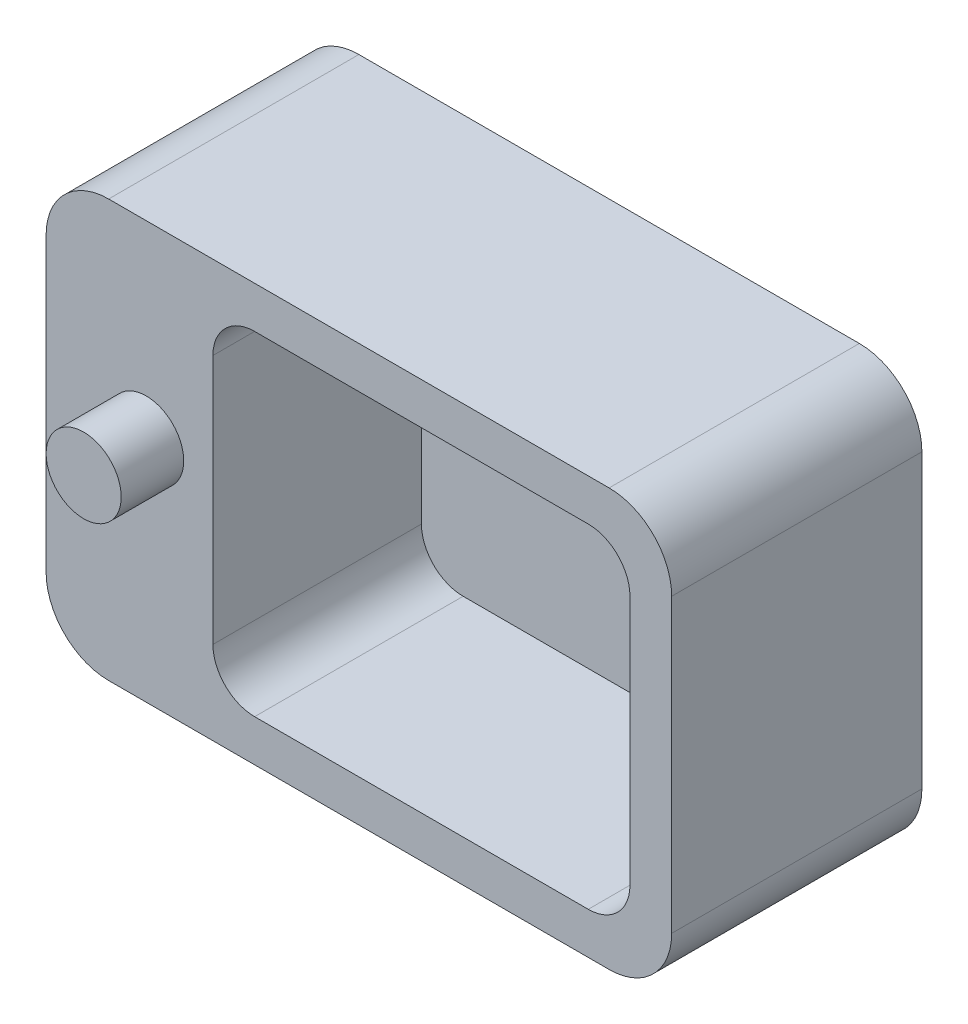
from build123d import *

# Parameters (mm, degrees)
BASE_EXTRUDE_DEPTH  = 60
CUT_EXTRUDE1_DEPTH  = 50
SKETCH3_R           = 9
BOSS_EXTRUDE1_DEPTH = 15


with BuildPart() as part:
    # Sketch1 → Base-Extrude (new body)
    with BuildSketch(Plane.XY):
        with BuildLine():
            Line((15, 0), (135, 0))
            ThreePointArc((135, 0), (145.606601718, 4.393398282), (150, 15))
            Line((150, 15), (150, 85))
            ThreePointArc((150, 85), (145.606601718, 95.606601718), (135, 100))
            Line((135, 100), (15, 100))
            ThreePointArc((15, 100), (4.393398282, 95.606601718), (0, 85))
            Line((0, 85), (0, 15))
            ThreePointArc((0, 15), (4.393398282, 4.393398282), (15, 0))
        make_face()
    extrude(amount=BASE_EXTRUDE_DEPTH)

    # Sketch2 → Cut-Extrude1 (cut)
    with BuildSketch(Plane.XY.offset(60)):
        with BuildLine():
            Line((40, 80), (40, 20))
            ThreePointArc((40, 20), (42.928932188, 12.928932188), (50, 10))
            Line((50, 10), (130, 10))
            ThreePointArc((130, 10), (137.071067812, 12.928932188), (140, 20))
            Line((140, 20), (140, 80))
            ThreePointArc((140, 80), (137.071067812, 87.071067812), (130, 90))
            Line((130, 90), (50, 90))
            ThreePointArc((50, 90), (42.928932188, 87.071067812), (40, 80))
        make_face()
    extrude(amount=-CUT_EXTRUDE1_DEPTH, mode=Mode.SUBTRACT)

    # Sketch3 → Boss-Extrude1 (add)
    with BuildSketch(Plane.XY.offset(60)):
        with Locations(Location((24, 54.61, 0), (0, 0, 180))):
            Circle(SKETCH3_R)
    extrude(amount=BOSS_EXTRUDE1_DEPTH)


solid = part.part
